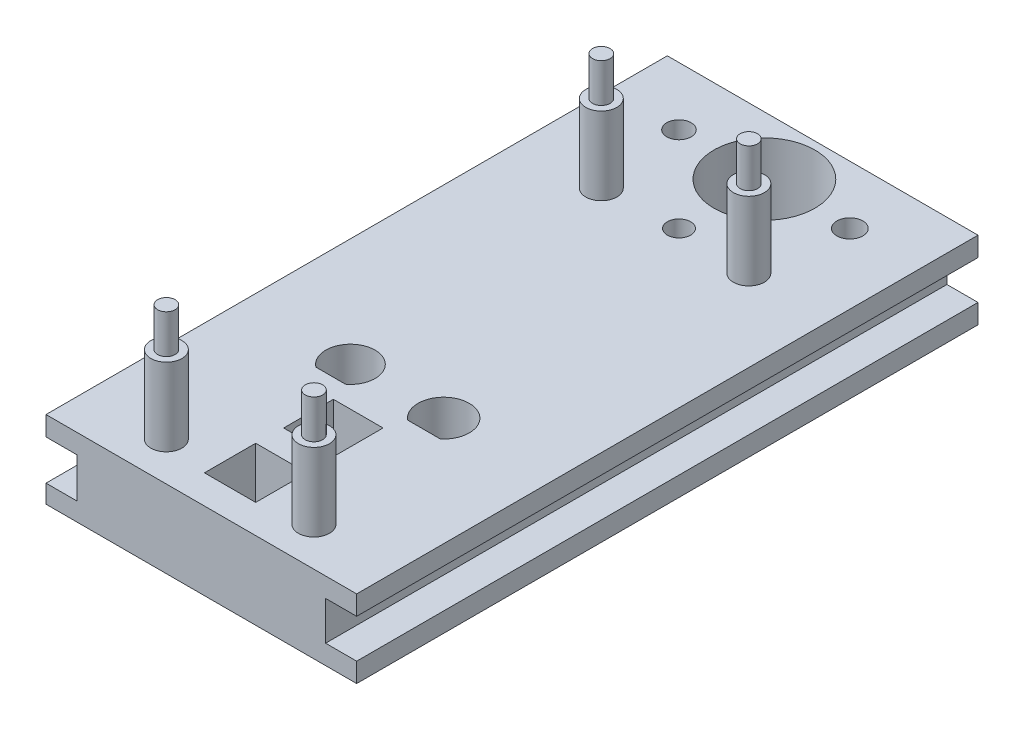
from build123d import *

# Parameters (mm, degrees)
ESQUISSE2_W             = 40
ESQUISSE2_H             = 80
BOSS_EXTRU_1_DEPTH      = 10
ESQUISSE3_R             = 2
BOSS_EXTRU_2_DEPTH      = 10
ESQUISSE4_R             = 1.125
BOSS_EXTRU_3_DEPTH      = 5
ENL_V_MAT_EXTRU_1_REACH = 49.17
ESQUISSE5_R             = 1.5
ESQUISSE5_R_2           = 1.575
ESQUISSE5_R_3           = 1.675
ESQUISSE5_R_4           = 6.5
ENL_V_MAT_EXTRU_2_REACH = 49.17
ESQUISSE6_W             = 6.6
ESQUISSE6_H             = 6.6
ESQUISSE6_W_2           = 6.4
ESQUISSE6_H_2           = 6.4
ENL_V_MAT_EXTRU_3_DEPTH = 10
ENL_V_MAT_EXTRU_4_REACH = 88.168
ESQUISSE8_W             = 4
ESQUISSE8_H             = 5
ESQUISSE8_H_2           = 5.15


with BuildPart() as part:
    # Esquisse2 → Boss.-Extru.1 (new body)
    with BuildSketch(Plane(origin=(0, 0, 0), x_dir=(1, 0, 0), z_dir=(0, 1, 0))):
        Rectangle(ESQUISSE2_W, ESQUISSE2_H)
    extrude(amount=BOSS_EXTRU_1_DEPTH)

    # Esquisse3 → Boss.-Extru.2 (add)
    with BuildSketch(Plane(origin=(0, 10, 0), x_dir=(1, 0, 0), z_dir=(0, 1, 0))):
        with Locations(Location((9.5, -35, 0), (0, 0, 270))):
            Circle(ESQUISSE3_R)
        with Locations(Location((9.5, 21, 0), (0, 0, 270))):
            Circle(ESQUISSE3_R)
        with Locations(Location((-9.5, -35, 0), (0, 0, 270))):
            Circle(ESQUISSE3_R)
        with Locations(Location((-9.5, 21, 0), (0, 0, 270))):
            Circle(ESQUISSE3_R)
    extrude(amount=BOSS_EXTRU_2_DEPTH)

    # Esquisse4 → Boss.-Extru.3 (add)
    with BuildSketch(Plane(origin=(0, 20, 0), x_dir=(1, 0, 0), z_dir=(0, 1, 0))):
        with Locations(Location((-9.5, -35, 0), (0, 0, 270))):
            Circle(ESQUISSE4_R)
        with Locations(Location((9.5, -35, 0), (0, 0, 270))):
            Circle(ESQUISSE4_R)
        with Locations(Location((-9.5, 21, 0), (0, 0, 270))):
            Circle(ESQUISSE4_R)
        with Locations(Location((9.5, 21, 0), (0, 0, 270))):
            Circle(ESQUISSE4_R)
    extrude(amount=BOSS_EXTRU_3_DEPTH)

    # Esquisse5 → Enlèv. mat.-Extru.1 (cut, up to next)
    with BuildSketch(Plane(origin=(0, 10, 0), x_dir=(1, 0, 0), z_dir=(0, 1, 0)), mode=Mode.PRIVATE) as enl_v_mat_extru_1_sk1:
        with Locations(Location((0, 21.5, 0), (0, 0, 270))):
            Circle(ESQUISSE5_R)
    enl_v_mat_extru_1_tool1 = extrude(enl_v_mat_extru_1_sk1.sketch, amount=-ENL_V_MAT_EXTRU_1_REACH, mode=Mode.PRIVATE) & part.part
    # Esquisse5 → Enlèv. mat.-Extru.1 (cut, up to next)
    with BuildSketch(Plane(origin=(0, 10, 0), x_dir=(1, 0, 0), z_dir=(0, 1, 0)), mode=Mode.PRIVATE) as enl_v_mat_extru_1_sk2:
        with Locations(Location((-11, 32.5, 0), (0, 0, 270))):
            Circle(ESQUISSE5_R_2)
    enl_v_mat_extru_1_tool2 = extrude(enl_v_mat_extru_1_sk2.sketch, amount=-ENL_V_MAT_EXTRU_1_REACH, mode=Mode.PRIVATE) & part.part
    # Esquisse5 → Enlèv. mat.-Extru.1 (cut, up to next)
    with BuildSketch(Plane(origin=(0, 10, 0), x_dir=(1, 0, 0), z_dir=(0, 1, 0)), mode=Mode.PRIVATE) as enl_v_mat_extru_1_sk3:
        with Locations(Location((11, 32.5, 0), (0, 0, 270))):
            Circle(ESQUISSE5_R_3)
    enl_v_mat_extru_1_tool3 = extrude(enl_v_mat_extru_1_sk3.sketch, amount=-ENL_V_MAT_EXTRU_1_REACH, mode=Mode.PRIVATE) & part.part
    # Esquisse5 → Enlèv. mat.-Extru.1 (cut, up to next)
    with BuildSketch(Plane(origin=(0, 10, 0), x_dir=(1, 0, 0), z_dir=(0, 1, 0)), mode=Mode.PRIVATE) as enl_v_mat_extru_1_sk4:
        with Locations(Location((0, 32.5, 0), (0, 0, 270))):
            Circle(ESQUISSE5_R_4)
    enl_v_mat_extru_1_tool4 = extrude(enl_v_mat_extru_1_sk4.sketch, amount=-ENL_V_MAT_EXTRU_1_REACH, mode=Mode.PRIVATE) & part.part
    add(enl_v_mat_extru_1_tool1.solids().sort_by_distance((0, 10, -21.5))[0], mode=Mode.SUBTRACT)
    add(enl_v_mat_extru_1_tool2.solids().sort_by_distance((-11, 10, -32.5))[0], mode=Mode.SUBTRACT)
    add(enl_v_mat_extru_1_tool3.solids().sort_by_distance((11, 10, -32.5))[0], mode=Mode.SUBTRACT)
    add(enl_v_mat_extru_1_tool4.solids().sort_by_distance((0, 10, -32.5))[0], mode=Mode.SUBTRACT)

    # Esquisse6 → Enlèv. mat.-Extru.2 (cut, up to next)
    with BuildSketch(Plane(origin=(0, 10, 0), x_dir=(1, 0, 0), z_dir=(0, 1, 0)), mode=Mode.PRIVATE) as enl_v_mat_extru_2_sk1:
        with Locations((0, -33)):
            Rectangle(ESQUISSE6_W, ESQUISSE6_H)
    enl_v_mat_extru_2_tool1 = extrude(enl_v_mat_extru_2_sk1.sketch, amount=-ENL_V_MAT_EXTRU_2_REACH, mode=Mode.PRIVATE) & part.part
    # Esquisse6 → Enlèv. mat.-Extru.2 (cut, up to next)
    with BuildSketch(Plane(origin=(0, 10, 0), x_dir=(1, 0, 0), z_dir=(0, 1, 0)), mode=Mode.PRIVATE) as enl_v_mat_extru_2_sk2:
        with Locations((0, -23)):
            Rectangle(ESQUISSE6_W_2, ESQUISSE6_H_2)
    enl_v_mat_extru_2_tool2 = extrude(enl_v_mat_extru_2_sk2.sketch, amount=-ENL_V_MAT_EXTRU_2_REACH, mode=Mode.PRIVATE) & part.part
    add(enl_v_mat_extru_2_tool1.solids().sort_by_distance((0, 10, 33))[0], mode=Mode.SUBTRACT)
    add(enl_v_mat_extru_2_tool2.solids().sort_by_distance((0, 10, 23))[0], mode=Mode.SUBTRACT)

    # Esquisse7 → Enlèv. mat.-Extru.3 (cut)
    with BuildSketch(Plane(origin=(0, 10, 0), x_dir=(1, 0, 0), z_dir=(0, 1, 0))):
        with BuildLine():
            Line((-7.905, -17.34), (-4.095, -17.34))
            ThreePointArc((-4.095, -17.34), (-6, -11.625), (-7.905, -17.34))
        make_face()
        with BuildLine():
            Line((3.890117539, -17.34), (8.109882461, -17.34))
            ThreePointArc((8.109882461, -17.34), (6, -11.498), (3.890117539, -17.34))
        make_face()
    extrude(amount=-ENL_V_MAT_EXTRU_3_DEPTH, mode=Mode.SUBTRACT)

    # Esquisse8 → Enlèv. mat.-Extru.4 (cut, up to next)
    with BuildSketch(Plane.XY.offset(40), mode=Mode.PRIVATE) as enl_v_mat_extru_4_sk1:
        with Locations((18, 5)):
            Rectangle(ESQUISSE8_W, ESQUISSE8_H)
    enl_v_mat_extru_4_tool1 = extrude(enl_v_mat_extru_4_sk1.sketch, amount=-ENL_V_MAT_EXTRU_4_REACH, mode=Mode.PRIVATE) & part.part
    # Esquisse8 → Enlèv. mat.-Extru.4 (cut, up to next)
    with BuildSketch(Plane.XY.offset(40), mode=Mode.PRIVATE) as enl_v_mat_extru_4_sk2:
        with Locations((-18, 4.925)):
            Rectangle(ESQUISSE8_W, ESQUISSE8_H_2)
    enl_v_mat_extru_4_tool2 = extrude(enl_v_mat_extru_4_sk2.sketch, amount=-ENL_V_MAT_EXTRU_4_REACH, mode=Mode.PRIVATE) & part.part
    add(enl_v_mat_extru_4_tool1.solids().sort_by_distance((18, 5, 40))[0], mode=Mode.SUBTRACT)
    add(enl_v_mat_extru_4_tool2.solids().sort_by_distance((-18, 4.925, 40))[0], mode=Mode.SUBTRACT)


solid = part.part
